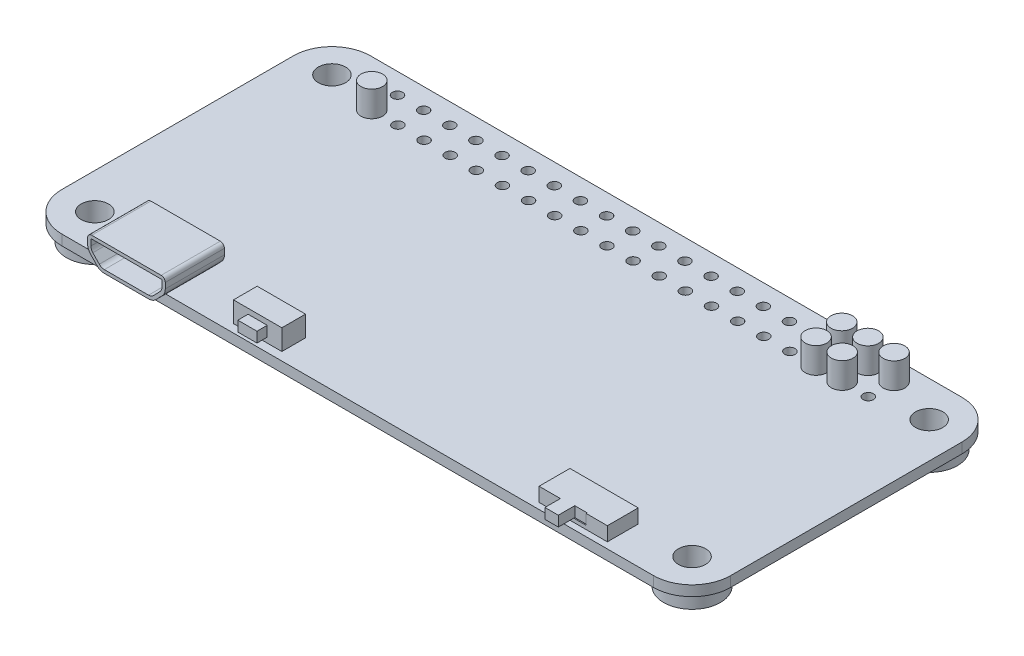
from build123d import *

# Parameters (mm, degrees)
BOSS_EXTRUDE1_DEPTH      = 1
SKETCH2_R                = 1.325
CUT_EXTRUDE1_DEPTH       = 36.80851854
SKETCH3_R                = 0.5
CUT_EXTRUDE2_DEPTH       = 36.80851854
LPATTERN1_COUNT          = 20
LPATTERN1_PITCH          = 2.54
BOSS_EXTRUDE6_DEPTH      = 1.25
BOSS_EXTRUDE6_DEPTH_BACK = 4.5
CUT_EXTRUDE9_DEPTH       = 5.25
SKETCH_1_W               = 4.7
SKETCH_1_H               = 2.3
EXTRUDE_1_DEPTH          = 2
SKETCH_2_W               = 1.86
SKETCH_2_H               = 1
EXTRUDE_2_DEPTH          = 1
SKETCH_6_W               = 6.64
SKETCH_6_H               = 3
EXTRUDE_6_DEPTH          = 1.36
SKETCH_7_W               = 2.5
SKETCH_7_H               = 1
CUT_EXTRUDE_1_DEPTH      = 0.1
SKETCH_8_W               = 1.3
SKETCH_8_H               = 1
EXTRUDE_7_DEPTH          = 1.6
SKETCH_9_R               = 2.75
SKETCH_9_R_2             = 1.325
EXTRUDE_8_DEPTH          = 1.5
SKETCH_10_R              = 1.05
EXTRUDE_9_DEPTH          = 2.5
SKETCH_11_R              = 0.5
EXTRUDE_10_DEPTH         = 3


with BuildPart() as part:
    # Sketch1 → Boss-Extrude1 (new body)
    with BuildSketch(Plane(origin=(0, 0, 0), x_dir=(1, 0, 0), z_dir=(0, 1, 0))):
        with BuildLine():
            Line((-28.75, 15), (28.75, 15))
            ThreePointArc((28.75, 15), (31.401650429, 13.901650429), (32.5, 11.25))
            Line((32.5, 11.25), (32.5, -11.25))
            ThreePointArc((32.5, -11.25), (31.401650429, -13.901650429), (28.75, -15))
            Line((28.75, -15), (-28.75, -15))
            ThreePointArc((-28.75, -15), (-31.401650429, -13.901650429), (-32.5, -11.25))
            Line((-32.5, -11.25), (-32.5, 11.25))
            ThreePointArc((-32.5, 11.25), (-31.401650429, 13.901650429), (-28.75, 15))
        make_face()
    extrude(amount=BOSS_EXTRUDE1_DEPTH)

    # Sketch2 → Cut-Extrude1 (cut, through all)
    with BuildSketch(Plane(origin=(0, 1, 0), x_dir=(1, 0, 0), z_dir=(0, 1, 0))):
        with Locations(Location((-29.025, 11.525, 0), (0, 0, 270))):
            Circle(SKETCH2_R)
        with Locations(Location((29.025, 11.525, 0), (0, 0, 90))):
            Circle(SKETCH2_R)
        with Locations(Location((29.025, -11.525, 0), (0, 0, 270))):
            Circle(SKETCH2_R)
        with Locations(Location((-29.025, -11.525, 0), (0, 0, 90))):
            Circle(SKETCH2_R)
    extrude(amount=-CUT_EXTRUDE1_DEPTH, mode=Mode.SUBTRACT)

    # Sketch3 → Cut-Extrude2 (cut, through all)
    with BuildSketch(Plane(origin=(0, 1, 0), x_dir=(1, 0, 0), z_dir=(0, 1, 0))):
        with Locations(Location((-24.128, 13, 0), (0, 0, 270))):
            Circle(SKETCH3_R)
        with Locations(Location((-24.128, 10.5, 0), (0, 0, 270))):
            Circle(SKETCH3_R)
    cut_extrude2 = extrude(amount=-CUT_EXTRUDE2_DEPTH, mode=Mode.SUBTRACT)

    # LPattern1: Cut-Extrude2 ×20
    with Locations(*[(i * LPATTERN1_PITCH, 0, 0) for i in range(1, LPATTERN1_COUNT)]):
        add(cut_extrude2, mode=Mode.SUBTRACT)

    # Sketch15 → Boss-Extrude6 (add, two sides: drawn at the far end of the back side and taken through both)
    with BuildSketch(Plane.XY.offset(15).offset(-BOSS_EXTRUDE6_DEPTH_BACK)):
        with BuildLine():
            Line((-24.6, 3.6), (-17.85, 3.6))
            ThreePointArc((-17.85, 3.6), (-17.567157288, 3.482842712), (-17.45, 3.2))
            Line((-17.45, 3.2), (-17.45, 2.652310288))
            ThreePointArc((-17.45, 2.652310288), (-17.522264229, 2.279072643), (-17.728612679, 1.959778459))
            Line((-17.728612679, 1.959778459), (-18.354830555, 1.307468172))
            ThreePointArc((-18.354830555, 1.307468172), (-18.684128491, 1.080072876), (-19.076217876, 1))
            Line((-19.076217876, 1), (-23.373782124, 1))
            ThreePointArc((-23.373782124, 1), (-23.765871509, 1.080072876), (-24.095169445, 1.307468172))
            Line((-24.095169445, 1.307468172), (-24.721387321, 1.959778459))
            ThreePointArc((-24.721387321, 1.959778459), (-24.927735771, 2.279072643), (-25, 2.652310288))
            Line((-25, 2.652310288), (-25, 3.2))
            ThreePointArc((-25, 3.2), (-24.882842712, 3.482842712), (-24.6, 3.6))
        make_face()
    extrude(amount=BOSS_EXTRUDE6_DEPTH + BOSS_EXTRUDE6_DEPTH_BACK)

    # Sketch16 → Cut-Extrude9 (cut)
    with BuildSketch(Plane.XY.offset(16.25)):
        with BuildLine():
            Line((-18.585674498, 1.529078357), (-17.959456622, 2.181388644))
            ThreePointArc((-17.959456622, 2.181388644), (-17.819139676, 2.398508689), (-17.77, 2.652310288))
            Line((-17.77, 2.652310288), (-17.77, 3.2))
            ThreePointArc((-17.77, 3.2), (-17.793431458, 3.256568542), (-17.85, 3.28))
            Line((-17.85, 3.28), (-24.6, 3.28))
            ThreePointArc((-24.6, 3.28), (-24.656568542, 3.256568542), (-24.68, 3.2))
            Line((-24.68, 3.2), (-24.68, 2.652310288))
            ThreePointArc((-24.68, 2.652310288), (-24.630860324, 2.398508689), (-24.490543378, 2.181388644))
            Line((-24.490543378, 2.181388644), (-23.864325502, 1.529078357))
            ThreePointArc((-23.864325502, 1.529078357), (-23.640402906, 1.374449555), (-23.373782124, 1.32))
            Line((-23.373782124, 1.32), (-19.076217876, 1.32))
            ThreePointArc((-19.076217876, 1.32), (-18.809597094, 1.374449555), (-18.585674498, 1.529078357))
        make_face()
    extrude(amount=-CUT_EXTRUDE9_DEPTH, mode=Mode.SUBTRACT)

    # 草图1 → 凸台-拉伸1 (add)
    with BuildSketch(Plane(origin=(0, 1, 0), x_dir=(1, 0, 0), z_dir=(0, 1, 0))):
        with Locations((-10.52, -13.05)):
            Rectangle(SKETCH_1_W, SKETCH_1_H)
    extrude(amount=EXTRUDE_1_DEPTH)

    # 草图2 → 凸台-拉伸2 (add)
    with BuildSketch(Plane.XY.offset(14.2)):
        with Locations((-10.52, 2)):
            Rectangle(SKETCH_2_W, SKETCH_2_H)
    extrude(amount=EXTRUDE_2_DEPTH)

    # 草图6 → 凸台-拉伸6 (add)
    with BuildSketch(Plane(origin=(0, 1, 0), x_dir=(1, 0, 0), z_dir=(0, 1, 0))):
        with Locations((20.35, -12.9)):
            Rectangle(SKETCH_6_W, SKETCH_6_H)
    extrude(amount=EXTRUDE_6_DEPTH)

    # 草图7 → 切除-拉伸1 (cut)
    with BuildSketch(Plane.XY.offset(14.4)):
        with Locations((20.35, 1.86)):
            Rectangle(SKETCH_7_W, SKETCH_7_H)
    extrude(amount=-CUT_EXTRUDE_1_DEPTH, mode=Mode.SUBTRACT)

    # 草图8 → 凸台-拉伸7 (add)
    with BuildSketch(Plane.XY.offset(14.3)):
        with Locations((19.75, 1.86)):
            Rectangle(SKETCH_8_W, SKETCH_8_H)
    extrude(amount=EXTRUDE_7_DEPTH)

    # 草图9 → 凸台-拉伸8 (add)
    # profile 1 of 4: a face of its own
    with BuildSketch(Plane.XZ):
        with Locations(Location((29.025, 11.525, 0), (0, 0, 90))):
            Circle(SKETCH_9_R)
        with Locations(Location((29.025, 11.525, 0), (0, 0, 90))):
            Circle(SKETCH_9_R_2, mode=Mode.SUBTRACT)
    # profile 2 of 4: a face of its own
    with BuildSketch(Plane.XZ):
        with Locations(Location((29.025, -11.525, 0), (0, 0, 90))):
            Circle(SKETCH_9_R)
        with Locations(Location((29.025, -11.525, 0), (0, 0, 270))):
            Circle(SKETCH_9_R_2, mode=Mode.SUBTRACT)
    # profile 3 of 4: a face of its own
    with BuildSketch(Plane.XZ):
        with Locations(Location((-29.025, 11.525, 0), (0, 0, 90))):
            Circle(SKETCH_9_R)
        with Locations(Location((-29.025, 11.525, 0), (0, 0, 270))):
            Circle(SKETCH_9_R_2, mode=Mode.SUBTRACT)
    # profile 4 of 4: a face of its own
    with BuildSketch(Plane.XZ):
        with Locations(Location((-29.025, -11.525, 0), (0, 0, 90))):
            Circle(SKETCH_9_R)
        with Locations(Location((-29.025, -11.525, 0), (0, 0, 90))):
            Circle(SKETCH_9_R_2, mode=Mode.SUBTRACT)
    extrude(amount=EXTRUDE_8_DEPTH)

    # 草图10 → 凸台-拉伸9 (add)
    with BuildSketch(Plane(origin=(0, 1, 0), x_dir=(1, 0, 0), z_dir=(0, 1, 0))):
        with Locations(Location((24.132, 13, 0), (0, 0, 270))):
            Circle(SKETCH_10_R)
        with Locations(Location((21.592, 13, 0), (0, 0, 270))):
            Circle(SKETCH_10_R)
        with Locations(Location((19.052, 13, 0), (0, 0, 270))):
            Circle(SKETCH_10_R)
        with Locations(Location((21.592, 10.5, 0), (0, 0, 270))):
            Circle(SKETCH_10_R)
        with Locations(Location((19.052, 10.5, 0), (0, 0, 270))):
            Circle(SKETCH_10_R)
        with Locations(Location((-24.128, 10.5, 0), (0, 0, 270))):
            Circle(SKETCH_10_R)
    extrude(amount=EXTRUDE_9_DEPTH)

    # 草图11 → 凸台-拉伸10 (add)
    with BuildSketch(Plane.XZ.offset(-1)):
        with Locations(Location((24.132, -13, 0), (0, 0, 90))):
            Circle(SKETCH_11_R)
        with Locations(Location((21.592, -13, 0), (0, 0, 90))):
            Circle(SKETCH_11_R)
        with Locations(Location((21.592, -10.5, 0), (0, 0, 90))):
            Circle(SKETCH_11_R)
        with Locations(Location((19.052, -10.5, 0), (0, 0, 90))):
            Circle(SKETCH_11_R)
        with Locations(Location((19.052, -13, 0), (0, 0, 90))):
            Circle(SKETCH_11_R)
        with Locations(Location((-24.128, -10.5, 0), (0, 0, 90))):
            Circle(SKETCH_11_R)
    extrude(amount=EXTRUDE_10_DEPTH)


solid = part.part
